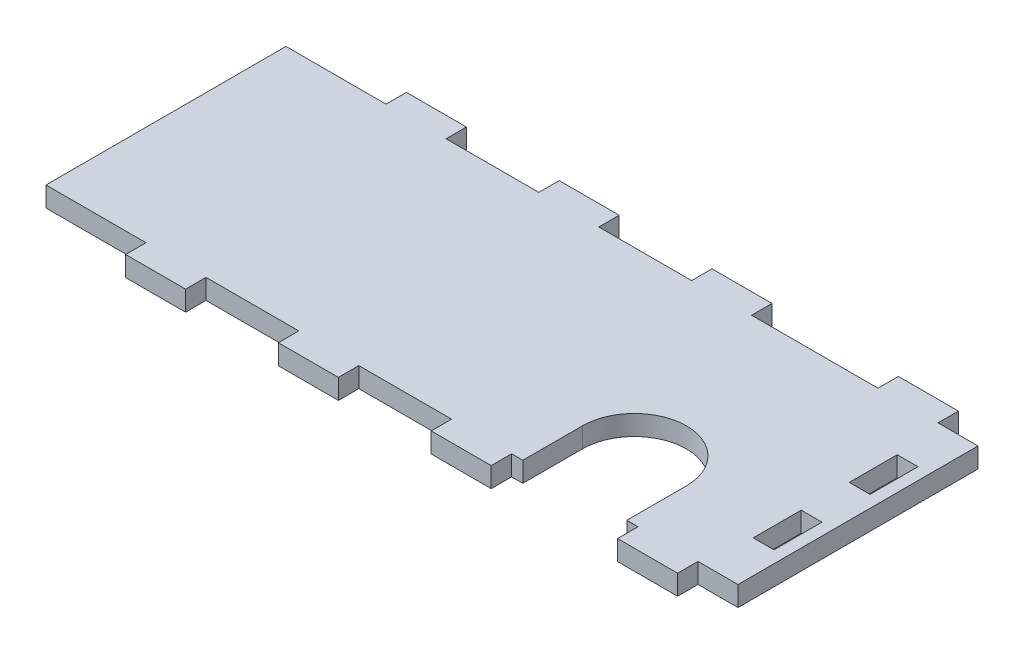
from build123d import *

# Parameters (mm, degrees)
SKETCH1_W           = 5.2
SKETCH1_H           = 12
BOSS_EXTRUDE1_DEPTH = 5


with BuildPart() as part:
    # Sketch1 → Boss-Extrude1 (new body)
    with BuildSketch(Plane(origin=(0, 0, 0), x_dir=(1, 0, 0), z_dir=(0, 1, 0))):
        with BuildLine():
            Line((56.6, 26.468421053), (56.6, -33.531578947))
            Line((56.6, -33.531578947), (46.6, -33.531578947))
            Line((46.6, -33.531578947), (46.6, -38.631578947))
            Line((46.6, -38.631578947), (31.6, -38.631578947))
            Line((31.6, -38.631578947), (31.6, -33.531578947))
            Line((31.6, -33.531578947), (28.8, -33.531578947))
            Line((28.8, -33.531578947), (28.8, -18.631578947))
            ThreePointArc((28.8, -18.631578947), (15.8, -5.631578947), (2.8, -18.631578947))
            Line((2.8, -18.631578947), (2.8, -33.531578947))
            Line((2.8, -33.531578947), (0, -33.531578947))
            Line((0, -33.531578947), (0, -38.631578947))
            Line((0, -38.631578947), (-15, -38.631578947))
            Line((-15, -38.631578947), (-15, -33.531578947))
            Line((-15, -33.531578947), (-38.2, -33.531578947))
            Line((-38.2, -33.531578947), (-38.2, -38.631578947))
            Line((-38.2, -38.631578947), (-53.2, -38.631578947))
            Line((-53.2, -38.631578947), (-53.2, -33.531578947))
            Line((-53.2, -33.531578947), (-76.4, -33.531578947))
            Line((-76.4, -33.531578947), (-76.4, -38.631578947))
            Line((-76.4, -38.631578947), (-91.4, -38.631578947))
            Line((-91.4, -38.631578947), (-91.4, -33.531578947))
            Line((-91.4, -33.531578947), (-116.4, -33.531578947))
            Line((-116.4, -33.531578947), (-116.4, 26.468421053))
            Line((-116.4, 26.468421053), (-91.4, 26.468421053))
            Line((-91.4, 26.468421053), (-91.4, 31.568421053))
            Line((-91.4, 31.568421053), (-76.4, 31.568421053))
            Line((-76.4, 31.568421053), (-76.4, 26.468421053))
            Line((-76.4, 26.468421053), (-53.2, 26.468421053))
            Line((-53.2, 26.468421053), (-53.2, 31.568421053))
            Line((-53.2, 31.568421053), (-38.2, 31.568421053))
            Line((-38.2, 31.568421053), (-38.2, 26.468421053))
            Line((-38.2, 26.468421053), (-15, 26.468421053))
            Line((-15, 26.468421053), (-15, 31.568421053))
            Line((-15, 31.568421053), (0, 31.568421053))
            Line((0, 31.568421053), (0, 26.468421053))
            Line((0, 26.468421053), (31.6, 26.468421053))
            Line((31.6, 26.468421053), (31.6, 31.568421053))
            Line((31.6, 31.568421053), (46.6, 31.568421053))
            Line((46.6, 31.568421053), (46.6, 26.468421053))
            Line((46.6, 26.468421053), (56.6, 26.468421053))
        make_face()
        with Locations((51, 8.468421053)):
            Rectangle(SKETCH1_W, SKETCH1_H, mode=Mode.SUBTRACT)
        with Locations((51, -15.531578947)):
            Rectangle(SKETCH1_W, SKETCH1_H, mode=Mode.SUBTRACT)
    extrude(amount=BOSS_EXTRUDE1_DEPTH)


solid = part.part
